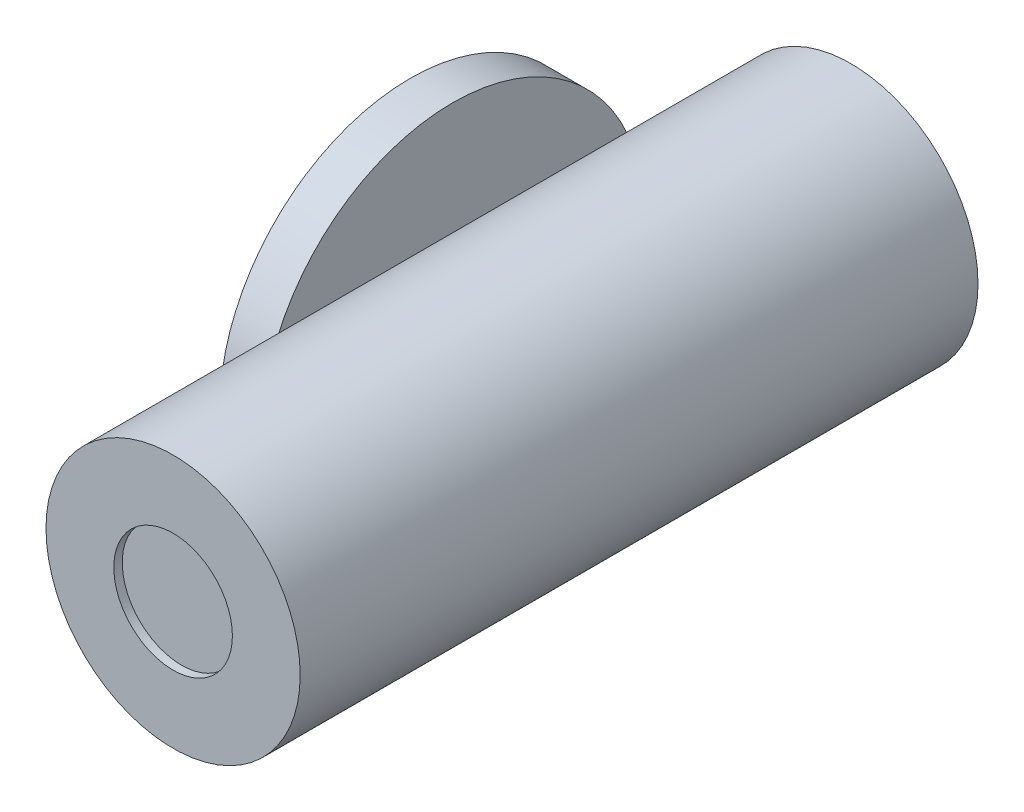
from build123d import *

# Parameters (mm, degrees)
ESQUISSE1_R             = 150
BOSS_EXTRU_1_DEPTH      = 800
ESQUISSE2_R             = 225
BOSS_EXTRU_2_DEPTH      = 50
ESQUISSE4_R             = 70
ENL_V_MAT_EXTRU_2_DEPTH = 10
ESQUISSE3_R             = 70
BOSS_EXTRU_3_DEPTH      = 10


with BuildPart() as part:
    # Esquisse1 → Boss.-Extru.1 (new body)
    with BuildSketch(Plane.XY):
        Circle(ESQUISSE1_R)
    extrude(amount=-BOSS_EXTRU_1_DEPTH)

    # Esquisse2 → Boss.-Extru.2 (add)
    with BuildSketch(Plane(origin=(-120, 0, 0), x_dir=(0, 0, -1), z_dir=(1, 0, 0))):
        with Locations((450, 0)):
            Circle(ESQUISSE2_R)
    extrude(amount=-BOSS_EXTRU_2_DEPTH)

    # Esquisse4 → Enlèv. mat.-Extru.2 (cut)
    with BuildSketch(Plane.XY):
        Circle(ESQUISSE4_R)
    extrude(amount=-ENL_V_MAT_EXTRU_2_DEPTH, mode=Mode.SUBTRACT)

    # Esquisse3 → Boss.-Extru.3 (add)
    with BuildSketch(Plane.ZY.offset(170)):
        with Locations((-450, 0)):
            Circle(ESQUISSE3_R)
    extrude(amount=BOSS_EXTRU_3_DEPTH)


solid = part.part
